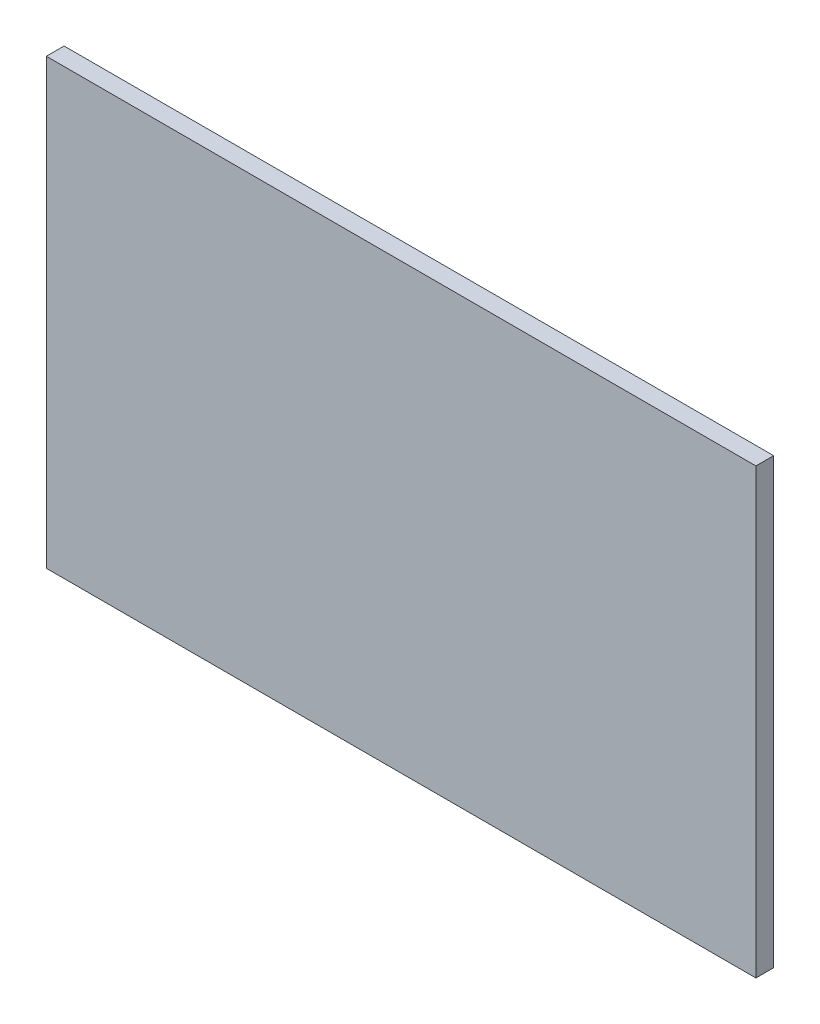
from build123d import *

# Parameters (mm, degrees)
ESBO_O1_W                = 800
ESBO_O1_H                = 500
RESSALTO_EXTRUS_O1_DEPTH = 20


with BuildPart() as part:
    # Esboço1 → Ressalto-extrusão1 (new body)
    with BuildSketch(Plane.XY):
        Rectangle(ESBO_O1_W, ESBO_O1_H)
    extrude(amount=RESSALTO_EXTRUS_O1_DEPTH)


solid = part.part
